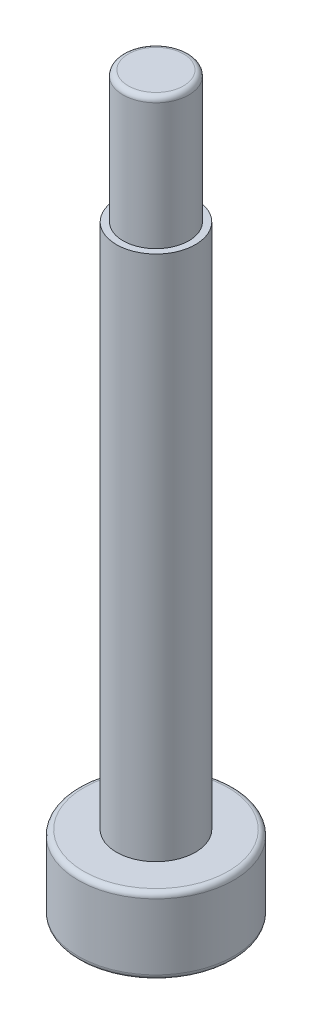
from build123d import *

# Parameters (mm, degrees)
SKETCH_1_R          = 2.95
EXTRUDE_1_DEPTH     = 2.9
SKETCH_2_R          = 1.5
EXTRUDE_2_DEPTH     = 20
SKETCH_3_R          = 1.25
EXTRUDE_3_DEPTH     = 5
CUT_EXTRUDE_1_DEPTH = 2
FILLET_1_R          = 0.2


with BuildPart() as part:
    # 草图1 → 凸台-拉伸1 (new body)
    with BuildSketch(Plane(origin=(0, 0, 0), x_dir=(1, 0, 0), z_dir=(0, 1, 0))):
        with Locations(Location((0, 0, 0), (0, 0, 270))):
            Circle(SKETCH_1_R)
    extrude(amount=EXTRUDE_1_DEPTH)

    # 草图2 → 凸台-拉伸2 (add)
    with BuildSketch(Plane(origin=(0, 2.9, 0), x_dir=(1, 0, 0), z_dir=(0, 1, 0))):
        with Locations(Location((0, 0, 0), (0, 0, 270))):
            Circle(SKETCH_2_R)
    extrude(amount=EXTRUDE_2_DEPTH)

    # 草图3 → 凸台-拉伸3 (add)
    with BuildSketch(Plane(origin=(0, 22.9, 0), x_dir=(1, 0, 0), z_dir=(0, 1, 0))):
        with Locations(Location((0, 0, 0), (0, 0, 270))):
            Circle(SKETCH_3_R)
    extrude(amount=EXTRUDE_3_DEPTH)

    # 草图4 → 切除-拉伸1 (cut)
    with BuildSketch(Plane.XZ):
        Polygon((2.247285488, -0.53201623), (1.584382314, 1.680198207), (-0.662903174, 2.212214437), (-2.247285488, 0.53201623), (-1.584382314, -1.680198207), (0.662903174, -2.212214437), align=None)
    extrude(amount=-CUT_EXTRUDE_1_DEPTH, mode=Mode.SUBTRACT)

    # 圆角1
    fillet_1_edges = [part.edges().sort_by_distance(p)[0] for p in [
        (0, 27.9, -1.25),
        (0, 0, -2.95),
        (0, 2.9, -2.95),
    ]]
    fillet(fillet_1_edges, radius=FILLET_1_R)


solid = part.part
